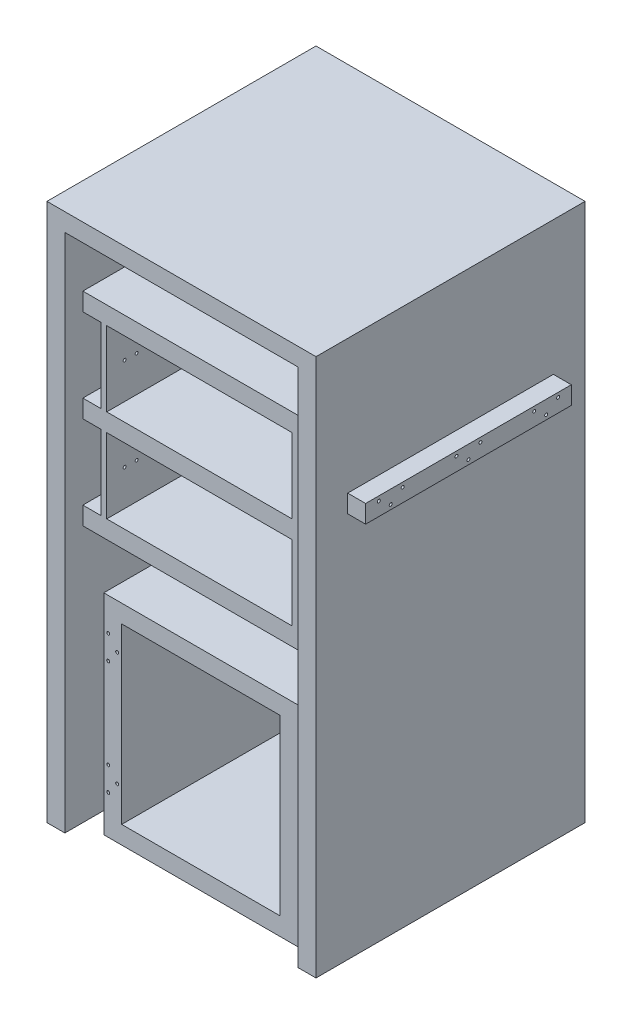
from build123d import *

# Parameters (mm, degrees)
SKETCH1_W            = 450
SKETCH1_H            = 900
BOSS_EXTRUDE1_DEPTH  = 225
SKETCH2_W            = 390
SKETCH2_H            = 870
CUT_EXTRUDE1_DEPTH   = 420
SKETCH3_W            = 390
SKETCH3_H            = 390
BOSS_EXTRUDE2_DEPTH  = 30
LPATTERN1_COUNT      = 3
LPATTERN1_PITCH      = 155
SKETCH5_W            = 325
SKETCH5_H            = 350.459165748
SKETCH5_W_2          = 265
SKETCH5_H_2          = 290.459165748
BOSS_EXTRUDE4_DEPTH  = 390
SKETCH6_W            = 390
SKETCH6_H            = 125
BOSS_EXTRUDE5_DEPTH  = 10
LPATTERN2_COUNT      = 2
LPATTERN2_PITCH      = 155
LPATTERN2_COUNT_DIR2 = 2
LPATTERN2_PITCH_DIR2 = 320
CUT_EXTRUDE2_REACH   = 632.496
SKETCH10_R           = 2.5
LPATTERN3_COUNT      = 2
LPATTERN3_PITCH      = 155
LPATTERN3_COUNT_DIR2 = 2
LPATTERN3_PITCH_DIR2 = 320
SKETCH13_W           = 450
SKETCH13_H           = 30
BOSS_EXTRUDE6_DEPTH  = 30
CUT_EXTRUDE4_REACH   = 677
SKETCH12_R           = 2.5
CUT_EXTRUDE5_START   = -10
SKETCH17_R           = 2.5
CUT_EXTRUDE5_DEPTH   = 677.276969435
SKETCH18_W           = 53
SKETCH18_H           = 30
CUT_EXTRUDE6_DEPTH   = 676
SKETCH19_W           = 53
SKETCH19_H           = 30
CUT_EXTRUDE7_DEPTH   = 30
SKETCH20_R           = 2.5
CUT_EXTRUDE8_DEPTH   = 10


with BuildPart() as part:
    # Sketch1 → Boss-Extrude1 (new, symmetric)
    with BuildSketch(Plane(origin=(0, 0, 0), x_dir=(0, 0, -1), z_dir=(1, 0, 0))):
        Rectangle(SKETCH1_W, SKETCH1_H)
    extrude(amount=BOSS_EXTRUDE1_DEPTH, both=True)

    # Sketch2 → Cut-Extrude1 (cut)
    with BuildSketch(Plane.XY.offset(225)):
        with Locations((0, -15)):
            Rectangle(SKETCH2_W, SKETCH2_H)
    extrude(amount=-CUT_EXTRUDE1_DEPTH, mode=Mode.SUBTRACT)

    # Sketch3 → Boss-Extrude2 (add)
    with BuildSketch(Plane(origin=(0, 320, 0), x_dir=(1, 0, 0), z_dir=(0, 1, 0))):
        Rectangle(SKETCH3_W, SKETCH3_H)
    boss_extrude2 = extrude(amount=-BOSS_EXTRUDE2_DEPTH)

    # LPattern1: Boss-Extrude2 ×3
    with Locations(*[(0, -i * LPATTERN1_PITCH, 0) for i in range(1, LPATTERN1_COUNT)]):
        add(boss_extrude2)

    # Sketch5 → Boss-Extrude4 (add)
    with BuildSketch(Plane.XY.offset(-195)):
        with Locations((2.5, -274.770417126)):
            Rectangle(SKETCH5_W, SKETCH5_H)
        with Locations((2.5, -274.770417126)):
            Rectangle(SKETCH5_W_2, SKETCH5_H_2, mode=Mode.SUBTRACT)
    extrude(amount=BOSS_EXTRUDE4_DEPTH)

    # Sketch6 → Boss-Extrude5 (add)
    with BuildSketch(Plane(origin=(-165, 0, 0), x_dir=(0, 0, -1), z_dir=(1, 0, 0))):
        with Locations((0, 227.5)):
            Rectangle(SKETCH6_W, SKETCH6_H)
    boss_extrude5 = extrude(amount=BOSS_EXTRUDE5_DEPTH)

    # LPattern2: Boss-Extrude5 2 × 2
    with Locations(*[(j * LPATTERN2_PITCH_DIR2, -i * LPATTERN2_PITCH, 0) for i in range(LPATTERN2_COUNT) for j in range(LPATTERN2_COUNT_DIR2) if (i, j) != (0, 0)]):
        add(boss_extrude5)

    # Sketch10 → Cut-Extrude2 (cut, up to next)
    with BuildSketch(Plane(origin=(-155, 0, 0), x_dir=(0, 0, -1), z_dir=(1, 0, 0)), mode=Mode.PRIVATE) as cut_extrude2_sk1:
        with Locations((-165, 225)):
            Circle(SKETCH10_R)
    cut_extrude2_tool1 = extrude(cut_extrude2_sk1.sketch, amount=-CUT_EXTRUDE2_REACH, mode=Mode.PRIVATE) & part.part
    # Sketch10 → Cut-Extrude2 (cut, up to next)
    with BuildSketch(Plane(origin=(-155, 0, 0), x_dir=(0, 0, -1), z_dir=(1, 0, 0)), mode=Mode.PRIVATE) as cut_extrude2_sk2:
        with Locations((-145, 225)):
            Circle(SKETCH10_R)
    cut_extrude2_tool2 = extrude(cut_extrude2_sk2.sketch, amount=-CUT_EXTRUDE2_REACH, mode=Mode.PRIVATE) & part.part
    # Sketch10 → Cut-Extrude2 (cut, up to next)
    with BuildSketch(Plane(origin=(-155, 0, 0), x_dir=(0, 0, -1), z_dir=(1, 0, 0)), mode=Mode.PRIVATE) as cut_extrude2_sk3:
        with Locations(Location((145, 225, 0), (0, 0, 180))):
            Circle(SKETCH10_R)
    cut_extrude2_tool3 = extrude(cut_extrude2_sk3.sketch, amount=-CUT_EXTRUDE2_REACH, mode=Mode.PRIVATE) & part.part
    # Sketch10 → Cut-Extrude2 (cut, up to next)
    with BuildSketch(Plane(origin=(-155, 0, 0), x_dir=(0, 0, -1), z_dir=(1, 0, 0)), mode=Mode.PRIVATE) as cut_extrude2_sk4:
        with Locations(Location((165, 225, 0), (0, 0, 180))):
            Circle(SKETCH10_R)
    cut_extrude2_tool4 = extrude(cut_extrude2_sk4.sketch, amount=-CUT_EXTRUDE2_REACH, mode=Mode.PRIVATE) & part.part
    cut_extrude2_1 = cut_extrude2_tool1.solids().sort_by_distance((-155, 225, 165))[0]
    add(cut_extrude2_1, mode=Mode.SUBTRACT)
    cut_extrude2_2 = cut_extrude2_tool2.solids().sort_by_distance((-155, 225, 145))[0]
    add(cut_extrude2_2, mode=Mode.SUBTRACT)
    cut_extrude2_3 = cut_extrude2_tool3.solids().sort_by_distance((-155, 225, -145))[0]
    add(cut_extrude2_3, mode=Mode.SUBTRACT)
    cut_extrude2_4 = cut_extrude2_tool4.solids().sort_by_distance((-155, 225, -165))[0]
    add(cut_extrude2_4, mode=Mode.SUBTRACT)
    cut_extrude2 = cut_extrude2_1 + cut_extrude2_2 + cut_extrude2_3 + cut_extrude2_4  # Cut-Extrude2 as one shape, for the pattern or mirror that repeats it

    # LPattern3: Cut-Extrude2 2 × 2
    with Locations(*[(j * LPATTERN3_PITCH_DIR2, -i * LPATTERN3_PITCH, 0) for i in range(LPATTERN3_COUNT) for j in range(LPATTERN3_COUNT_DIR2) if (i, j) != (0, 0)]):
        add(cut_extrude2, mode=Mode.SUBTRACT)

    # Sketch13 → Boss-Extrude6 (add)
    with BuildSketch(Plane(origin=(225, 0, 0), x_dir=(0, 0, -1), z_dir=(1, 0, 0))):
        with Locations((0, 210.86)):
            Rectangle(SKETCH13_W, SKETCH13_H)
    extrude(amount=BOSS_EXTRUDE6_DEPTH)

    # Sketch12 → Cut-Extrude4 (cut, up to next)
    with BuildSketch(Plane(origin=(225, 0, 0), x_dir=(0, 0, -1), z_dir=(1, 0, 0)), mode=Mode.PRIVATE) as cut_extrude4_sk1:
        with Locations(Location((-150, 218.36, 0), (0, 0, 180))):
            Circle(SKETCH12_R)
    cut_extrude4_tool1 = extrude(cut_extrude4_sk1.sketch, amount=CUT_EXTRUDE4_REACH, mode=Mode.PRIVATE) & part.part
    # Sketch12 → Cut-Extrude4 (cut, up to next)
    with BuildSketch(Plane(origin=(225, 0, 0), x_dir=(0, 0, -1), z_dir=(1, 0, 0)), mode=Mode.PRIVATE) as cut_extrude4_sk2:
        with Locations(Location((-110, 218.36, 0), (0, 0, 180))):
            Circle(SKETCH12_R)
    cut_extrude4_tool2 = extrude(cut_extrude4_sk2.sketch, amount=CUT_EXTRUDE4_REACH, mode=Mode.PRIVATE) & part.part
    # Sketch12 → Cut-Extrude4 (cut, up to next)
    with BuildSketch(Plane(origin=(225, 0, 0), x_dir=(0, 0, -1), z_dir=(1, 0, 0)), mode=Mode.PRIVATE) as cut_extrude4_sk3:
        with Locations(Location((-130, 203.36, 0), (0, 0, 180))):
            Circle(SKETCH12_R)
    cut_extrude4_tool3 = extrude(cut_extrude4_sk3.sketch, amount=CUT_EXTRUDE4_REACH, mode=Mode.PRIVATE) & part.part
    # Sketch12 → Cut-Extrude4 (cut, up to next)
    with BuildSketch(Plane(origin=(225, 0, 0), x_dir=(0, 0, -1), z_dir=(1, 0, 0)), mode=Mode.PRIVATE) as cut_extrude4_sk4:
        with Locations(Location((110, 218.36, 0), (0, 0, 180))):
            Circle(SKETCH12_R)
    cut_extrude4_tool4 = extrude(cut_extrude4_sk4.sketch, amount=CUT_EXTRUDE4_REACH, mode=Mode.PRIVATE) & part.part
    # Sketch12 → Cut-Extrude4 (cut, up to next)
    with BuildSketch(Plane(origin=(225, 0, 0), x_dir=(0, 0, -1), z_dir=(1, 0, 0)), mode=Mode.PRIVATE) as cut_extrude4_sk5:
        with Locations(Location((130, 203.36, 0), (0, 0, 180))):
            Circle(SKETCH12_R)
    cut_extrude4_tool5 = extrude(cut_extrude4_sk5.sketch, amount=CUT_EXTRUDE4_REACH, mode=Mode.PRIVATE) & part.part
    # Sketch12 → Cut-Extrude4 (cut, up to next)
    with BuildSketch(Plane(origin=(225, 0, 0), x_dir=(0, 0, -1), z_dir=(1, 0, 0)), mode=Mode.PRIVATE) as cut_extrude4_sk6:
        with Locations(Location((150, 218.36, 0), (0, 0, 180))):
            Circle(SKETCH12_R)
    cut_extrude4_tool6 = extrude(cut_extrude4_sk6.sketch, amount=CUT_EXTRUDE4_REACH, mode=Mode.PRIVATE) & part.part
    add(cut_extrude4_tool1.solids().sort_by_distance((225, 218.36, 150))[0], mode=Mode.SUBTRACT)
    add(cut_extrude4_tool2.solids().sort_by_distance((225, 218.36, 110))[0], mode=Mode.SUBTRACT)
    add(cut_extrude4_tool3.solids().sort_by_distance((225, 203.36, 130))[0], mode=Mode.SUBTRACT)
    add(cut_extrude4_tool4.solids().sort_by_distance((225, 218.36, -110))[0], mode=Mode.SUBTRACT)
    add(cut_extrude4_tool5.solids().sort_by_distance((225, 203.36, -130))[0], mode=Mode.SUBTRACT)
    add(cut_extrude4_tool6.solids().sort_by_distance((225, 218.36, -150))[0], mode=Mode.SUBTRACT)

    # Sketch17 → Cut-Extrude5 (cut)
    with BuildSketch(Plane.XY.offset(195).offset(CUT_EXTRUDE5_START)):
        with Locations(Location((-152.5, -194.540834252, 0), (0, 0, 180))):
            Circle(SKETCH17_R)
        with Locations(Location((-137.5, -174.540834252, 0), (0, 0, 180))):
            Circle(SKETCH17_R)
        with Locations(Location((-152.5, -154.540834252, 0), (0, 0, 180))):
            Circle(SKETCH17_R)
    cut_extrude5 = extrude(amount=CUT_EXTRUDE5_DEPTH, mode=Mode.SUBTRACT)

    # Mirror1: Cut-Extrude5 across plane
    add(cut_extrude5.mirror(Plane.ZX.offset(-269.770834252)), mode=Mode.SUBTRACT)

    # Sketch18 → Cut-Extrude6 (cut, through all)
    with BuildSketch(Plane(origin=(225, 0, 0), x_dir=(0, 0, -1), z_dir=(1, 0, 0))):
        with Locations((-198.5, 210.86)):
            Rectangle(SKETCH18_W, SKETCH18_H)
    extrude(amount=CUT_EXTRUDE6_DEPTH, mode=Mode.SUBTRACT)

    # Sketch19 → Cut-Extrude7 (cut)
    with BuildSketch(Plane(origin=(255, 0, 0), x_dir=(0, 0, -1), z_dir=(1, 0, 0))):
        with Locations((198.5, 210.86)):
            Rectangle(SKETCH19_W, SKETCH19_H)
    extrude(amount=-CUT_EXTRUDE7_DEPTH, mode=Mode.SUBTRACT)

    # Sketch20 → Cut-Extrude8 (cut)
    with BuildSketch(Plane(origin=(255, 0, 0), x_dir=(0, 0, -1), z_dir=(1, 0, 0))):
        with Locations((-20, 218.36)):
            Circle(SKETCH20_R)
        with Locations((0, 203.36)):
            Circle(SKETCH20_R)
        with Locations((20, 218.36)):
            Circle(SKETCH20_R)
    extrude(amount=-CUT_EXTRUDE8_DEPTH, mode=Mode.SUBTRACT)


solid = part.part
